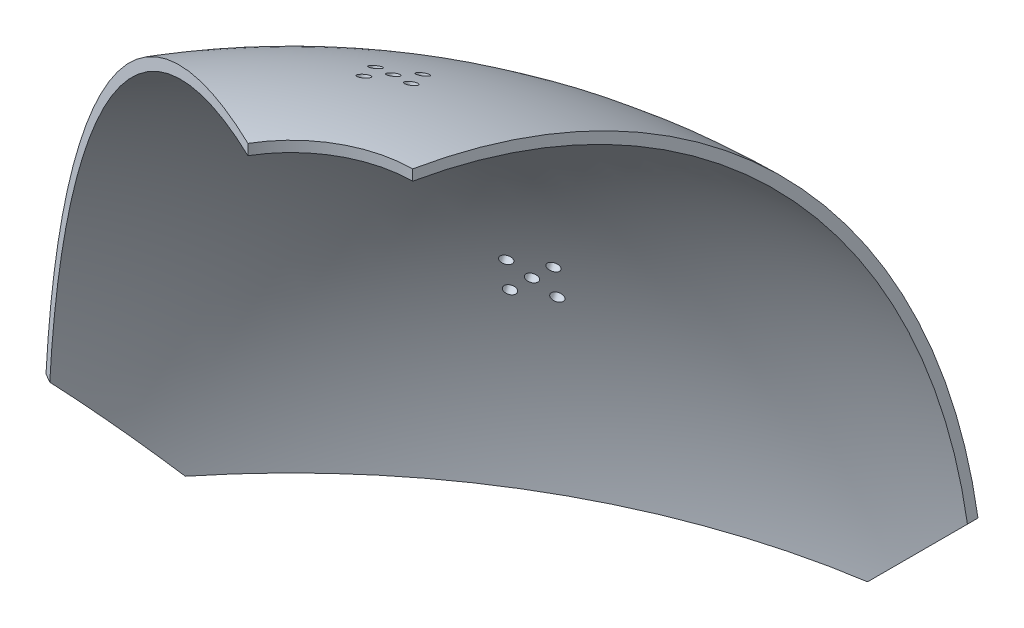
from build123d import *

# Parameters (mm, degrees)
REVOLVE_1_ANGLE     = 60
SKETCH_8_R          = 1.6
CUT_EXTRUDE_3_DEPTH = 332.662479036
SKETCH_10_R         = 1.6
CUT_EXTRUDE_4_DEPTH = 332.662479088
SKETCH_11_W         = 35
SKETCH_11_H         = 20
CHAMFER_1_SIZE      = 30
CUT_EXTRUDE_5_DEPTH = 329.100594503


with BuildPart() as part:
    # 草图2 → 旋转1 (revolve)
    with BuildSketch(Plane(origin=(0, 0, 0), x_dir=(0, 0, -1), z_dir=(1, 0, 0))):
        with BuildLine():
            Line((0, 200), (0, 197))
            ThreePointArc((0, 197), (75.388636176, 182.004267905), (139.300035894, 139.300035894))
            ThreePointArc((139.300035894, 139.300035894), (182.004267905, 75.388636176), (197, 0))
            Line((197, 0), (200, 0))
            ThreePointArc((200, 0), (141.421356237, 141.421356237), (0, 200))
        make_face()
    revolve(axis=Axis((0, 197, 0), (0, 1, 0)), revolution_arc=REVOLVE_1_ANGLE)

    # 草图8 → 切除-拉伸3 (cut, through all)
    with BuildSketch(Plane(origin=(0, 0, 0), x_dir=(0.8660254037844386, 0, -0.5000000000000002), z_dir=(-0.19937453446262515, 0.9170600743851224, -0.34532682342465876))):
        with Locations(Location((0, 0, 0), (0, 0, 62.100351935))):
            Circle(SKETCH_8_R)
        with Locations(Location((-4.949747468, 4.949747468, 0), (0, 0, 95.114838475))):
            Circle(SKETCH_8_R)
        with Locations(Location((4.949747468, 4.949747468, 0), (0, 0, 101.025540747))):
            Circle(SKETCH_8_R)
        with Locations(Location((4.949747468, -4.949747468, 0), (0, 0, 86.577458875))):
            Circle(SKETCH_8_R)
        with Locations(Location((-4.949747468, -4.949747468, 0), (0, 0, 104.176390161))):
            Circle(SKETCH_8_R)
    extrude(amount=CUT_EXTRUDE_3_DEPTH, mode=Mode.SUBTRACT)

    # 草图10 → 切除-拉伸4 (cut, through all)
    with BuildSketch(Plane(origin=(0, 0, 0), x_dir=(0.8660254037844386, 0, -0.5000000000000002), z_dir=(-0.47685847537411413, 0.3007057995042705, -0.8259431073677975))):
        Circle(SKETCH_10_R)
        with Locations(Location((-4.949747468, 4.949747468, 0), (0, 0, 101.967706736))):
            Circle(SKETCH_10_R)
        with Locations(Location((4.949747468, 4.949747468, 0), (0, 0, 83.084543913))):
            Circle(SKETCH_10_R)
        with Locations(Location((4.949747468, -4.949747468, 0), (0, 0, 82.97731383))):
            Circle(SKETCH_10_R)
        with Locations(Location((-4.949747468, -4.949747468, 0), (0, 0, 51.370315846))):
            Circle(SKETCH_10_R)
    extrude(amount=CUT_EXTRUDE_4_DEPTH, mode=Mode.SUBTRACT)

    # 草图11 → 切除-旋转1 (revolve, cut)
    with BuildSketch(Plane(origin=(0, 0, 0), x_dir=(0.4999999999999999, 0, 0.8660254037844387), z_dir=(-0.8660254037844387, 0, 0.4999999999999999))):
        with Locations((-17.5, 190)):
            Rectangle(SKETCH_11_W, SKETCH_11_H)
    revolve(axis=Axis((0, 200, 0), (0, -1, 0)), mode=Mode.SUBTRACT)

    # 倒角1
    chamfer_1_edges = [part.edges().sort_by_distance(p)[0] for p in [
        (-171.906042651, 0, -99.25),
        (0, 0, -198.5),
    ]]
    chamfer(chamfer_1_edges, length=CHAMFER_1_SIZE)

    # 草图12 → 切除-拉伸5 (cut, through all)
    with BuildSketch(Plane.XZ):
        Polygon((-192.418148626, -57.049421845), (0, 0), (-170.705595106, -100.553280072), align=None)
        Polygon((-1.742591743, -199.681235604), (64.809464755, -200.262026602), (0, 0), align=None)
    extrude(amount=-CUT_EXTRUDE_5_DEPTH, mode=Mode.SUBTRACT)


solid = part.part
